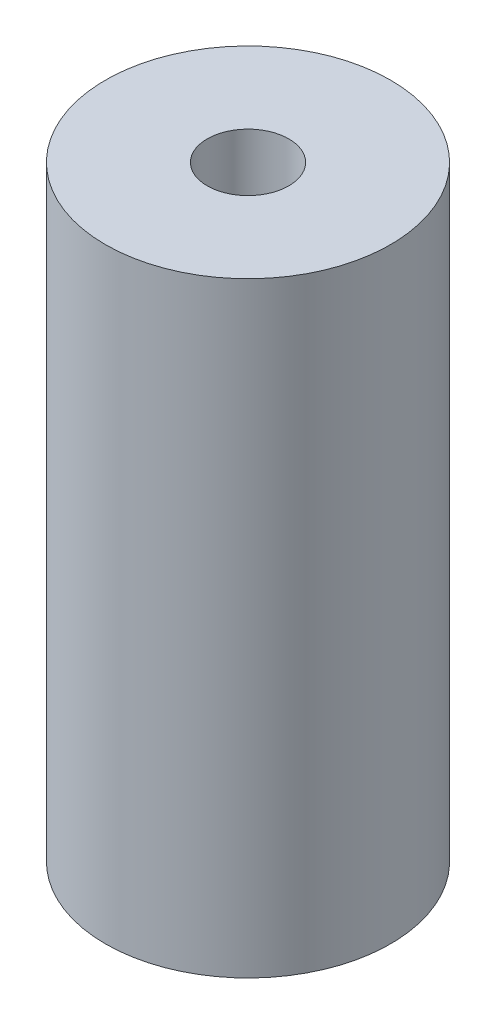
from build123d import *

# Parameters (mm, degrees)
SKETCH1_R           = 7.7724
SKETCH1_R_2         = 2.2225
BOSS_EXTRUDE1_DEPTH = 33.02


with BuildPart() as part:
    # Sketch1 → Boss-Extrude1 (new body)
    with BuildSketch(Plane(origin=(0, 0, 0), x_dir=(1, 0, 0), z_dir=(0, 1, 0))):
        with Locations(Location((0, 0, 0), (0, 0, 270))):
            Circle(SKETCH1_R)
        with Locations(Location((0, 0, 0), (0, 0, 270))):
            Circle(SKETCH1_R_2, mode=Mode.SUBTRACT)
    extrude(amount=BOSS_EXTRUDE1_DEPTH)


solid = part.part
